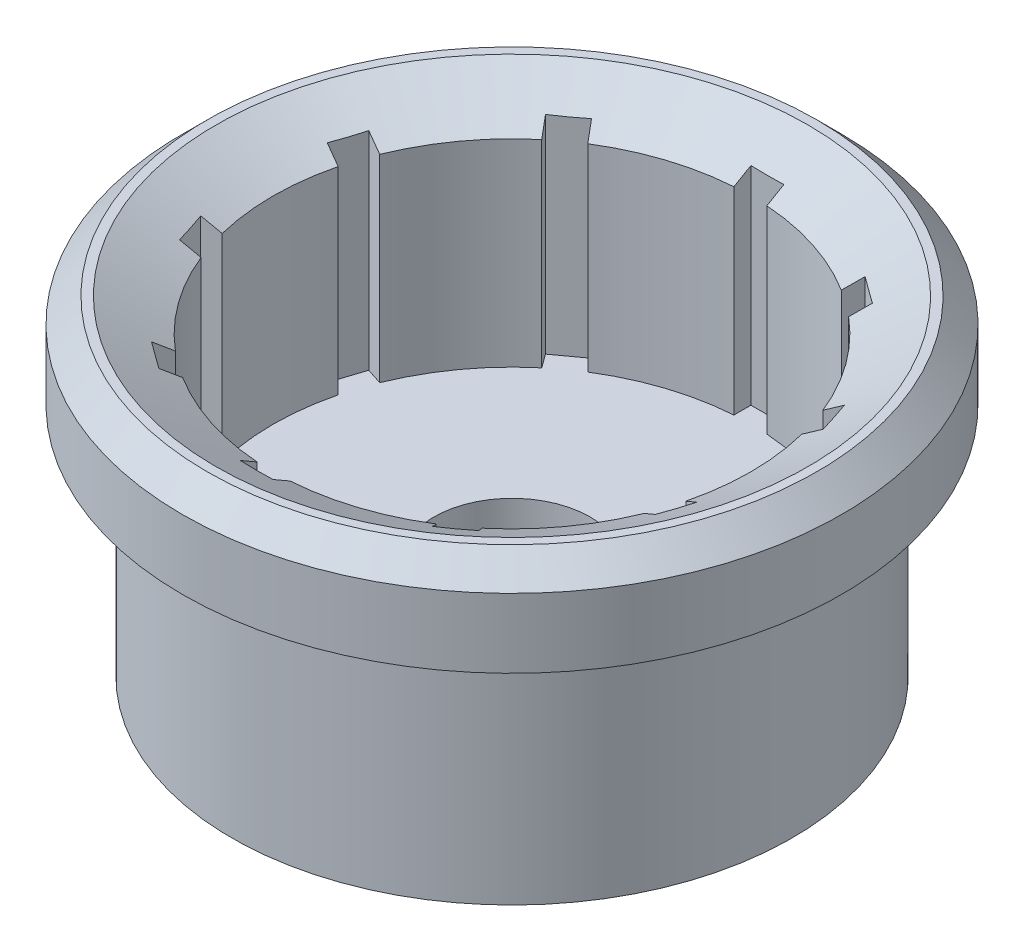
from build123d import *

# Parameters (mm, degrees)
CHAMFER_1_SIZE           = 2
CHAMFER_1_SIZE2          = 3.464101615
CHAMFER_2_SIZE           = 1.5
SKETCH_2_W               = 2
SKETCH_2_H               = 31
CUT_EXTRUDE_1_DEPTH      = 32.559467676
PATTERN_CIRCULAR_1_COUNT = 10


with BuildPart() as part:
    # 草图1 → 旋转1 (revolve)
    with BuildSketch(Plane.XY, mode=Mode.PRIVATE) as revolve_1_sk:
        Polygon((-2.5, 0), (-2.5, 8), (-4.75, 8), (-4.75, 12), (-14.5, 12), (-14.5, 26), (-20, 26), (-20, 20.3), (-17, 20.3), (-17, 6), (-6.5, 6), (-6.5, 5), (-4.5, 5), (-4.5, 0), align=None)
    revolve(revolve_1_sk.sketch.rotate(Axis((0, 0, 0), (0, 1, 0)), 270), axis=Axis((0, 0, 0), (0, 1, 0)))

    # 倒角1
    chamfer_1_edges = [part.edges().sort_by_distance(p)[0] for p in [
        (0, 26, 14.5),
    ]]
    chamfer_1_side = [part.faces().sort_by_distance(p)[0] for p in [
        (0, 19, 14.5),
    ]]
    chamfer(chamfer_1_edges, length=CHAMFER_1_SIZE, length2=CHAMFER_1_SIZE2, reference=chamfer_1_side[0])

    # 倒角2
    chamfer_2_edges = [part.edges().sort_by_distance(p)[0] for p in [
        (0, 26, 20),
    ]]
    chamfer(chamfer_2_edges, length=CHAMFER_2_SIZE)

    # 草图2 → 切除-拉伸1 (cut, through all)
    with BuildSketch(Plane(origin=(0, 12, 0), x_dir=(1, 0, 0), z_dir=(0, 1, 0))):
        Rectangle(SKETCH_2_W, SKETCH_2_H)
    cut_extrude_1 = extrude(amount=CUT_EXTRUDE_1_DEPTH, mode=Mode.SUBTRACT)

    # 阵列(圆周)1: 切除-拉伸1 ×10 about axis
    pattern_circular_1_axis = Axis((0, 0, 0), (0, 1, 0))
    for i in range(1, PATTERN_CIRCULAR_1_COUNT):
        add(cut_extrude_1.rotate(pattern_circular_1_axis, i * 360 / PATTERN_CIRCULAR_1_COUNT), mode=Mode.SUBTRACT)


solid = part.part
